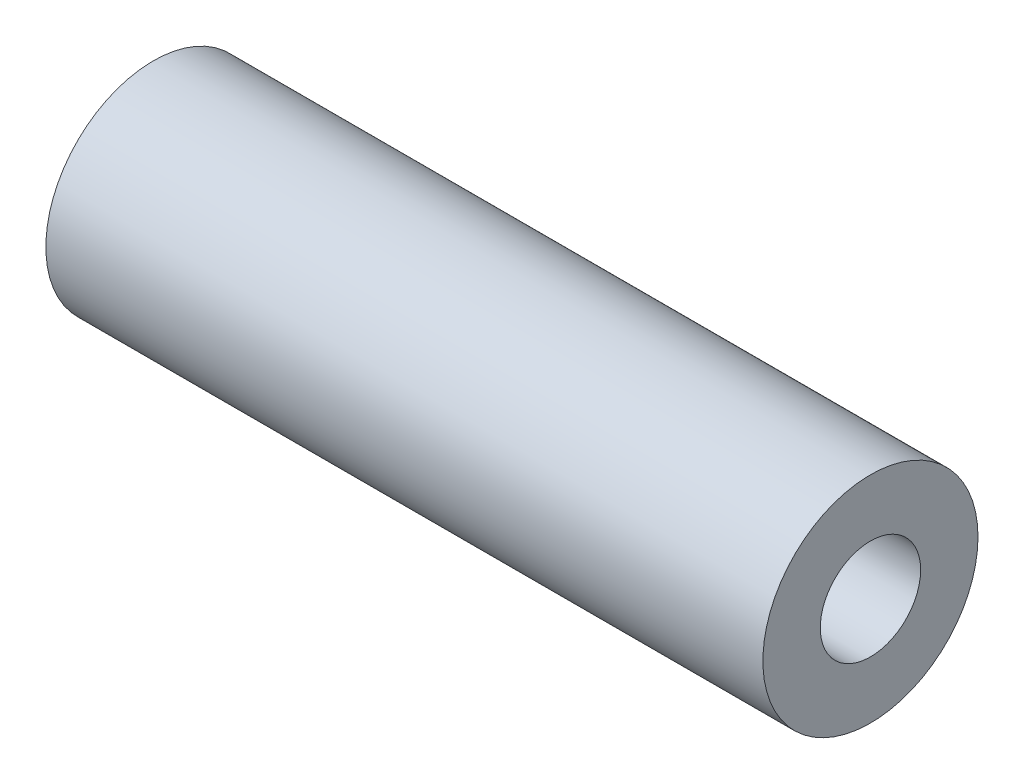
from build123d import *

# Parameters (mm, degrees)
SKETCH_1_R      = 4.5
SKETCH_1_R_2    = 2.1
EXTRUDE_1_DEPTH = 30


with BuildPart() as part:
    # 草图1 → 凸台-拉伸1 (new body)
    with BuildSketch(Plane(origin=(0, 0, 0), x_dir=(0, 0, -1), z_dir=(1, 0, 0))):
        Circle(SKETCH_1_R)
        Circle(SKETCH_1_R_2, mode=Mode.SUBTRACT)
    extrude(amount=EXTRUDE_1_DEPTH)


solid = part.part
